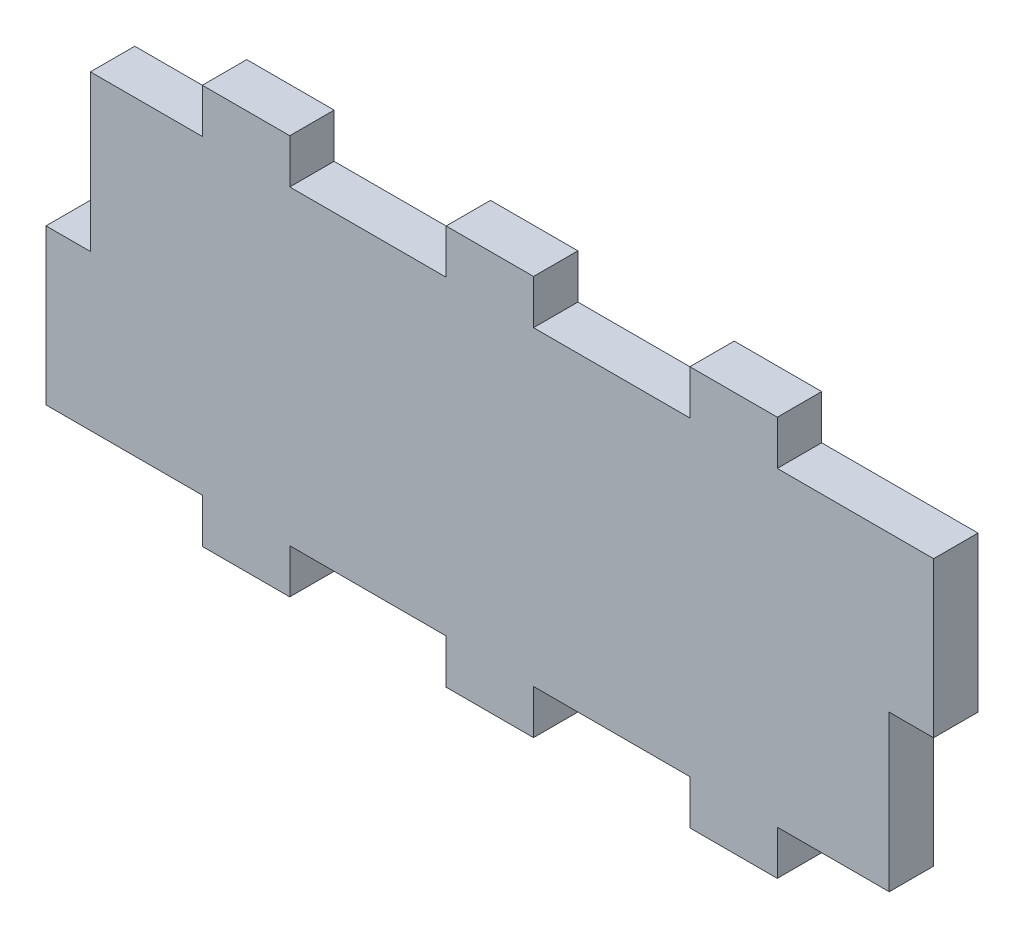
from build123d import *

# Parameters (mm, degrees)
SKETCH2_W           = 90
SKETCH2_H           = 35
SKETCH2_W_2         = 5
SKETCH2_H_2         = 17.475
SKETCH2_W_3         = 9.85
SKETCH2_H_3         = 5
BOSS_EXTRUDE1_DEPTH = 5


with BuildPart() as part:
    # Sketch2 → Boss-Extrude1 (new body)
    with BuildSketch(Plane.XY):
        Rectangle(SKETCH2_W, SKETCH2_H)
        with Locations((-47.5, -8.7625)):
            Rectangle(SKETCH2_W_2, SKETCH2_H_2)
        with Locations((-27.4625, 20)):
            Rectangle(SKETCH2_W_3, SKETCH2_H_3)
        with Locations((0, 20)):
            Rectangle(SKETCH2_W_3, SKETCH2_H_3)
        with Locations((27.4625, 20)):
            Rectangle(SKETCH2_W_3, SKETCH2_H_3)
        with Locations((47.5, 8.7625)):
            Rectangle(SKETCH2_W_2, SKETCH2_H_2)
        with Locations((27.4625, -20)):
            Rectangle(SKETCH2_W_3, SKETCH2_H_3)
        with Locations((0, -20)):
            Rectangle(SKETCH2_W_3, SKETCH2_H_3)
        with Locations((-27.4625, -20)):
            Rectangle(SKETCH2_W_3, SKETCH2_H_3)
    extrude(amount=BOSS_EXTRUDE1_DEPTH)


solid = part.part
